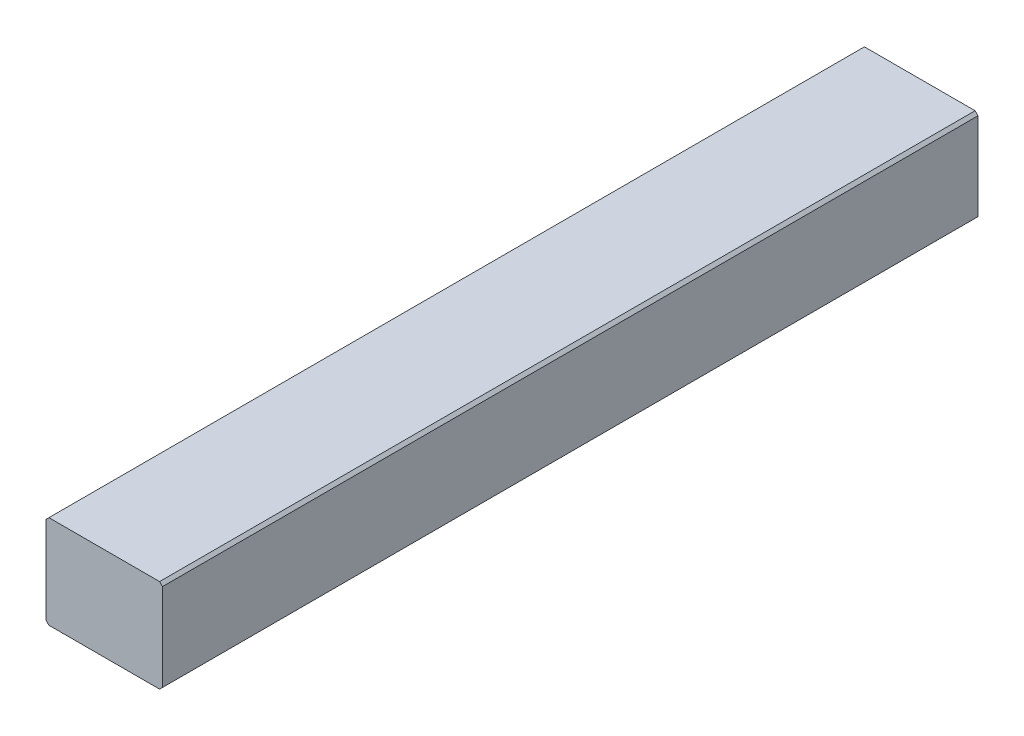
from build123d import *

# Parameters (mm, degrees)
SKETCH1_W      = 10
SKETCH1_H      = 8
EXTRUDE1_DEPTH = 70
CHAMFER1_SIZE  = 0.25


with BuildPart() as part:
    # Sketch1 → Extrude1 (new body)
    with BuildSketch(Plane.XY):
        Rectangle(SKETCH1_W, SKETCH1_H)
    extrude(amount=EXTRUDE1_DEPTH)

    # Chamfer1
    chamfer1_edges = [part.edges().sort_by_distance(p)[0] for p in [
        (5, -4, 35),
        (-5, -4, 35),
        (-5, 4, 35),
        (5, 4, 35),
    ]]
    chamfer(chamfer1_edges, length=CHAMFER1_SIZE)


solid = part.part
